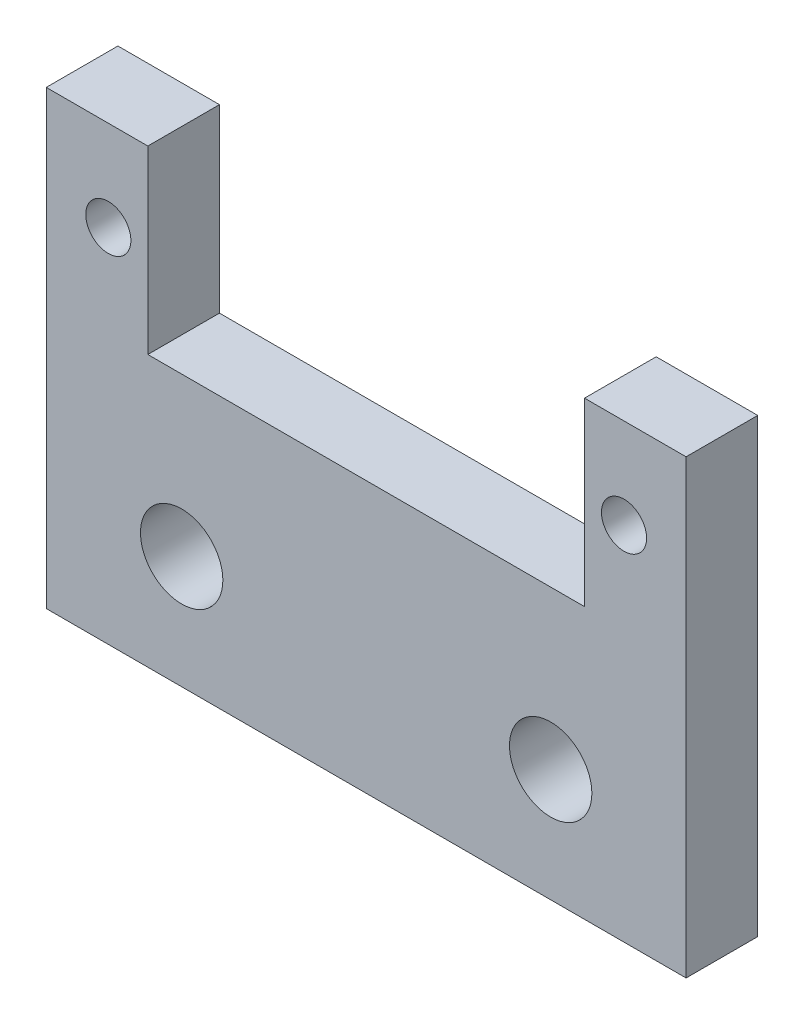
from build123d import *

# Parameters (mm, degrees)
SKETCH1_R           = 1
SKETCH1_R_2         = 1.825
BOSS_EXTRUDE1_DEPTH = 3.175


with BuildPart() as part:
    # Sketch1 → Boss-Extrude1 (new body)
    with BuildSketch(Plane.XY):
        Polygon((0, 8), (0, 0), (0, -12), (28.35, -12), (28.35, 8), (23.85, 8), (23.85, 0), (4.5, 0), (4.5, 8), align=None)
        with Locations((2.75, 4)):
            Circle(SKETCH1_R, mode=Mode.SUBTRACT)
        with Locations((25.6, 4)):
            Circle(SKETCH1_R, mode=Mode.SUBTRACT)
        with Locations((6, -7)):
            Circle(SKETCH1_R_2, mode=Mode.SUBTRACT)
        with Locations((22.35, -7)):
            Circle(SKETCH1_R_2, mode=Mode.SUBTRACT)
    extrude(amount=BOSS_EXTRUDE1_DEPTH)


solid = part.part
